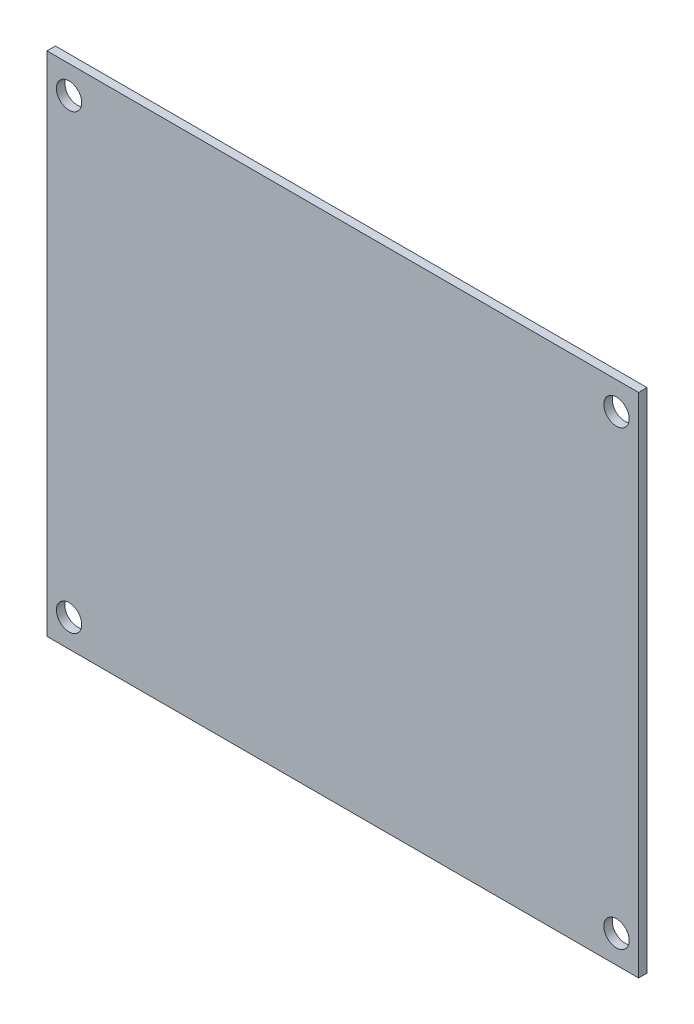
from build123d import *

# Parameters (mm, degrees)
ESBO_O1_W                = 70
ESBO_O1_H                = 60
ESBO_O1_R                = 1.5
RESSALTO_EXTRUS_O1_DEPTH = 1


with BuildPart() as part:
    # Esboço1 → Ressalto-extrusão1 (new body)
    with BuildSketch(Plane.XY):
        Rectangle(ESBO_O1_W, ESBO_O1_H)
        with Locations((-32.385, 26.73)):
            Circle(ESBO_O1_R, mode=Mode.SUBTRACT)
        with Locations((-32.385, -26.73)):
            Circle(ESBO_O1_R, mode=Mode.SUBTRACT)
        with Locations((32.385, -26.73)):
            Circle(ESBO_O1_R, mode=Mode.SUBTRACT)
        with Locations((32.385, 26.73)):
            Circle(ESBO_O1_R, mode=Mode.SUBTRACT)
    extrude(amount=RESSALTO_EXTRUS_O1_DEPTH)


solid = part.part
